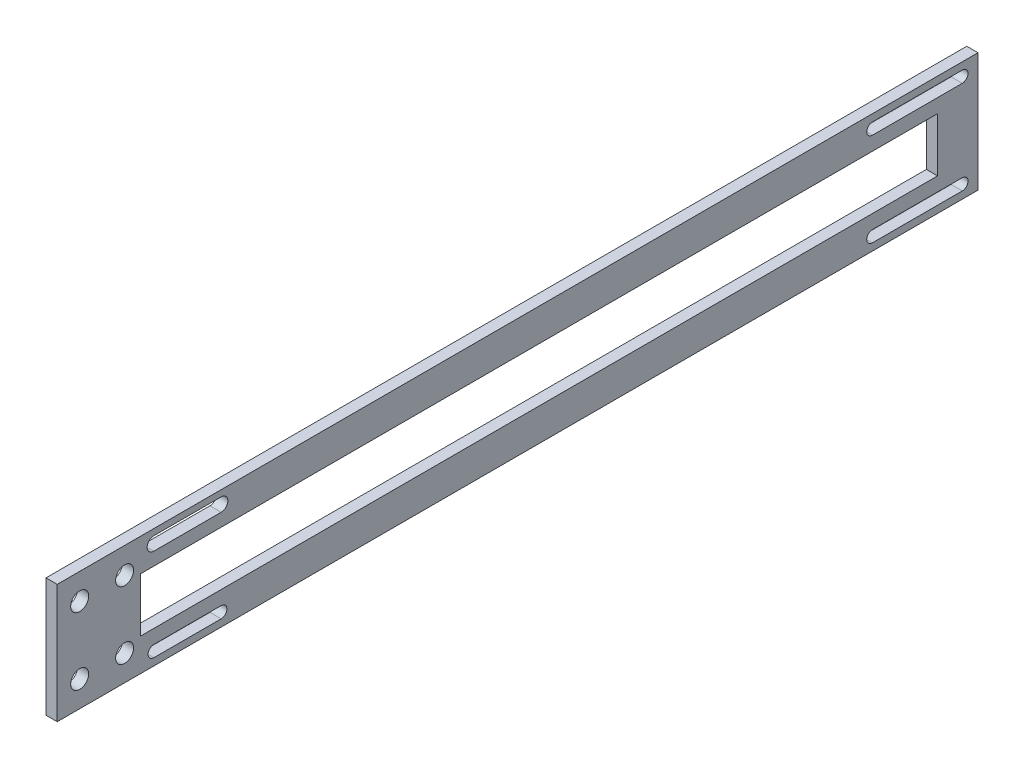
from build123d import *

# Parameters (mm, degrees)
SKETCH_1_W          = 5
SKETCH_1_H          = 410
EXTRUDE_1_DEPTH     = 53
CUT_EXTRUDE_1_REACH = 401.01
CUT_EXTRUDE_2_REACH = 401.01
CUT_EXTRUDE_3_REACH = 401.01
SKETCH_4_R          = 4


with BuildPart() as part:
    # 草图1 → 凸台-拉伸1 (new body)
    with BuildSketch(Plane(origin=(0, 0, 0), x_dir=(1, 0, 0), z_dir=(0, 1, 0))):
        with Locations((-0.791139241, 190.443037975)):
            Rectangle(SKETCH_1_W, SKETCH_1_H)
    extrude(amount=EXTRUDE_1_DEPTH)

    # 草图2 → 切除-拉伸1 (cut, up to next)
    with BuildSketch(Plane(origin=(1.708860759, 0, 0), x_dir=(0, 0, -1), z_dir=(1, 0, 0)), mode=Mode.PRIVATE) as cut_extrude_1_sk1:
        with BuildLine():
            Line((58.443037975, 44.280521885), (28.443037975, 44.280521885))
            ThreePointArc((28.443037975, 44.280521885), (25.47355986, 47.25), (28.443037975, 50.219478115))
            Line((28.443037975, 50.219478115), (58.443037975, 50.219478115))
            ThreePointArc((58.443037975, 50.219478115), (61.41251609, 47.25), (58.443037975, 44.280521885))
        make_face()
    cut_extrude_1_tool1 = extrude(cut_extrude_1_sk1.sketch, amount=-CUT_EXTRUDE_1_REACH, mode=Mode.PRIVATE) & part.part
    # 草图2 → 切除-拉伸1 (cut, up to next)
    with BuildSketch(Plane(origin=(1.708860759, 0, 0), x_dir=(0, 0, -1), z_dir=(1, 0, 0)), mode=Mode.PRIVATE) as cut_extrude_1_sk2:
        with BuildLine():
            Line((58.443037975, 3.2), (28.443037975, 3.2))
            ThreePointArc((28.443037975, 3.2), (25.893037975, 5.75), (28.443037975, 8.3))
            Line((28.443037975, 8.3), (58.443037975, 8.3))
            ThreePointArc((58.443037975, 8.3), (60.993037975, 5.75), (58.443037975, 3.2))
        make_face()
    cut_extrude_1_tool2 = extrude(cut_extrude_1_sk2.sketch, amount=-CUT_EXTRUDE_1_REACH, mode=Mode.PRIVATE) & part.part
    # 草图2 → 切除-拉伸1 (cut, up to next)
    with BuildSketch(Plane(origin=(1.708860759, 0, 0), x_dir=(0, 0, -1), z_dir=(1, 0, 0)), mode=Mode.PRIVATE) as cut_extrude_1_sk3:
        with BuildLine():
            Line((348.443037975, 49.8), (388.443037975, 49.8))
            ThreePointArc((388.443037975, 49.8), (390.993037975, 47.25), (388.443037975, 44.7))
            Line((388.443037975, 44.7), (348.443037975, 44.7))
            ThreePointArc((348.443037975, 44.7), (345.893037975, 47.25), (348.443037975, 49.8))
        make_face()
    cut_extrude_1_tool3 = extrude(cut_extrude_1_sk3.sketch, amount=-CUT_EXTRUDE_1_REACH, mode=Mode.PRIVATE) & part.part
    # 草图2 → 切除-拉伸1 (cut, up to next)
    with BuildSketch(Plane(origin=(1.708860759, 0, 0), x_dir=(0, 0, -1), z_dir=(1, 0, 0)), mode=Mode.PRIVATE) as cut_extrude_1_sk4:
        with BuildLine():
            Line((348.443037975, 8.3), (388.443037975, 8.3))
            ThreePointArc((388.443037975, 8.3), (390.993037975, 5.75), (388.443037975, 3.2))
            Line((388.443037975, 3.2), (348.443037975, 3.2))
            ThreePointArc((348.443037975, 3.2), (345.893037975, 5.75), (348.443037975, 8.3))
        make_face()
    cut_extrude_1_tool4 = extrude(cut_extrude_1_sk4.sketch, amount=-CUT_EXTRUDE_1_REACH, mode=Mode.PRIVATE) & part.part
    add(cut_extrude_1_tool1.solids().sort_by_distance((1.708861, 47.25, -43.443038))[0], mode=Mode.SUBTRACT)
    add(cut_extrude_1_tool2.solids().sort_by_distance((1.708861, 5.75, -43.443038))[0], mode=Mode.SUBTRACT)
    add(cut_extrude_1_tool3.solids().sort_by_distance((1.708861, 47.25, -368.443038))[0], mode=Mode.SUBTRACT)
    add(cut_extrude_1_tool4.solids().sort_by_distance((1.708861, 5.75, -368.443038))[0], mode=Mode.SUBTRACT)

    # 草图3 → 切除-拉伸2 (cut, up to next)
    with BuildSketch(Plane(origin=(1.708860759, 0, 0), x_dir=(0, 0, -1), z_dir=(1, 0, 0)), mode=Mode.PRIVATE) as cut_extrude_2_sk1:
        Polygon((22.443037975, 26.5), (22.443037975, 38.5), (377.443037975, 38.5), (377.443037975, 14.5), (22.443037975, 14.5), align=None)
    cut_extrude_2_tool1 = extrude(cut_extrude_2_sk1.sketch, amount=-CUT_EXTRUDE_2_REACH, mode=Mode.PRIVATE) & part.part
    add(cut_extrude_2_tool1.solids().sort_by_distance((1.708861, 26.5, -199.943038))[0], mode=Mode.SUBTRACT)

    # 草图4 → 切除-拉伸3 (cut, up to next)
    with BuildSketch(Plane(origin=(1.708860759, 0, 0), x_dir=(0, 0, -1), z_dir=(1, 0, 0)), mode=Mode.PRIVATE) as cut_extrude_3_sk1:
        with Locations((-4.556962025, 41.5)):
            Circle(SKETCH_4_R)
    cut_extrude_3_tool1 = extrude(cut_extrude_3_sk1.sketch, amount=-CUT_EXTRUDE_3_REACH, mode=Mode.PRIVATE) & part.part
    # 草图4 → 切除-拉伸3 (cut, up to next)
    with BuildSketch(Plane(origin=(1.708860759, 0, 0), x_dir=(0, 0, -1), z_dir=(1, 0, 0)), mode=Mode.PRIVATE) as cut_extrude_3_sk2:
        with Locations((15.443037975, 41.5)):
            Circle(SKETCH_4_R)
    cut_extrude_3_tool2 = extrude(cut_extrude_3_sk2.sketch, amount=-CUT_EXTRUDE_3_REACH, mode=Mode.PRIVATE) & part.part
    # 草图4 → 切除-拉伸3 (cut, up to next)
    with BuildSketch(Plane(origin=(1.708860759, 0, 0), x_dir=(0, 0, -1), z_dir=(1, 0, 0)), mode=Mode.PRIVATE) as cut_extrude_3_sk3:
        with Locations((15.443037975, 11.5)):
            Circle(SKETCH_4_R)
    cut_extrude_3_tool3 = extrude(cut_extrude_3_sk3.sketch, amount=-CUT_EXTRUDE_3_REACH, mode=Mode.PRIVATE) & part.part
    # 草图4 → 切除-拉伸3 (cut, up to next)
    with BuildSketch(Plane(origin=(1.708860759, 0, 0), x_dir=(0, 0, -1), z_dir=(1, 0, 0)), mode=Mode.PRIVATE) as cut_extrude_3_sk4:
        with Locations((-4.556962025, 11.5)):
            Circle(SKETCH_4_R)
    cut_extrude_3_tool4 = extrude(cut_extrude_3_sk4.sketch, amount=-CUT_EXTRUDE_3_REACH, mode=Mode.PRIVATE) & part.part
    add(cut_extrude_3_tool1.solids().sort_by_distance((1.708861, 41.5, 4.556962))[0], mode=Mode.SUBTRACT)
    add(cut_extrude_3_tool2.solids().sort_by_distance((1.708861, 41.5, -15.443038))[0], mode=Mode.SUBTRACT)
    add(cut_extrude_3_tool3.solids().sort_by_distance((1.708861, 11.5, -15.443038))[0], mode=Mode.SUBTRACT)
    add(cut_extrude_3_tool4.solids().sort_by_distance((1.708861, 11.5, 4.556962))[0], mode=Mode.SUBTRACT)


solid = part.part
